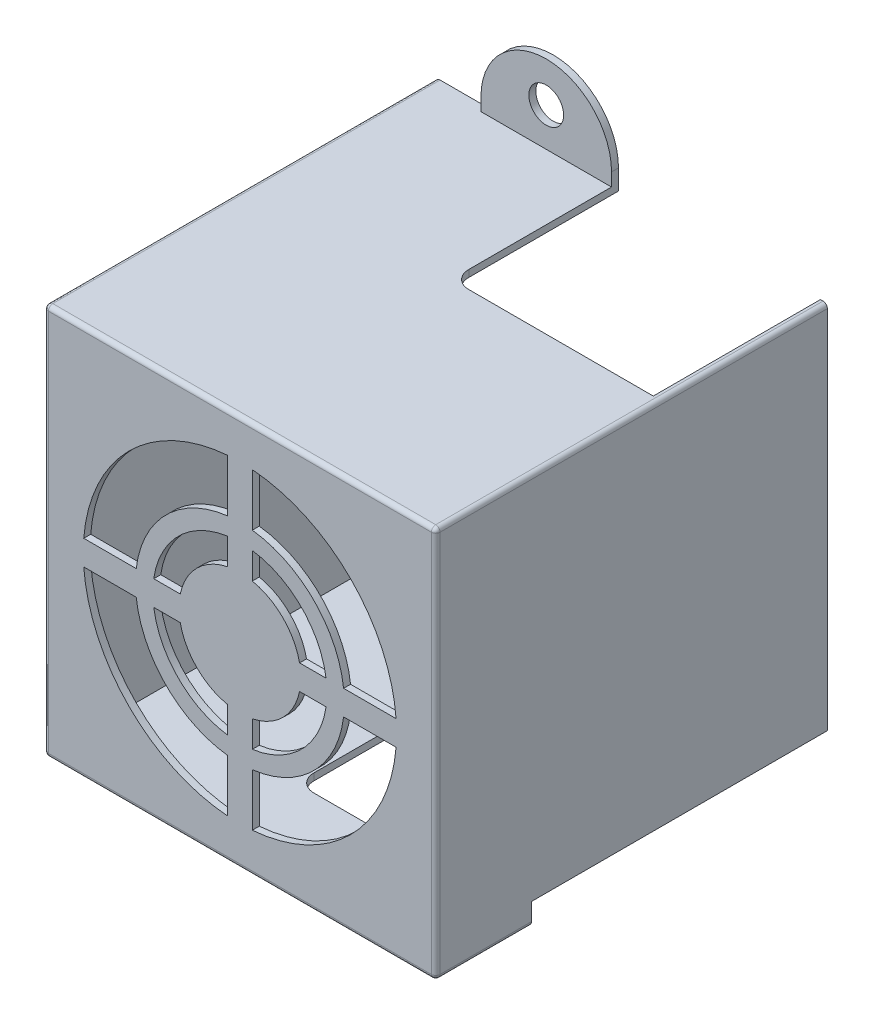
from build123d import *

# Parameters (mm, degrees)
SKETCH1_W           = 45
SKETCH1_H           = 45
BOSS_EXTRUDE1_DEPTH = 45
SHELL1_T            = -0.8
CUT_EXTRUDE1_DEPTH  = 45
SKETCH3_W           = 34
SKETCH3_H           = 2.5
CUT_EXTRUDE2_DEPTH  = 27
FILLET1_R           = 2
FILLET2_R           = 0.5
FILLET3_R           = 0.5
SKETCH4_R           = 2
BOSS_EXTRUDE2_DEPTH = 0.8
CUT_EXTRUDE4_DEPTH  = 0.8


with BuildPart() as part:
    # Sketch1 → Boss-Extrude1 (new body)
    with BuildSketch(Plane(origin=(0, 0, 0), x_dir=(1, 0, 0), z_dir=(0, 1, 0))):
        with Locations((22.5, -22.5)):
            Rectangle(SKETCH1_W, SKETCH1_H)
    extrude(amount=BOSS_EXTRUDE1_DEPTH)

    # Shell1
    shell1_openings = [part.faces().sort_by_distance(p)[0] for p in [
        (22.5, 22.5, 0),
    ]]
    offset(amount=SHELL1_T, openings=shell1_openings, kind=Kind.INTERSECTION)

    # Sketch2 → Cut-Extrude1 (cut)
    with BuildSketch(Plane.XY.offset(45)):
        with BuildLine():
            Line((21.076744556, 34.415298735), (21.076744556, 40.443643553))
            ThreePointArc((21.076744556, 40.443643553), (9.772077939, 35.227922061), (4.556356447, 23.923255444))
            Line((4.556356447, 23.923255444), (10.584701265, 23.923255444))
            ThreePointArc((10.584701265, 23.923255444), (14.014718626, 30.985281374), (21.076744556, 34.415298735))
        make_face()
        with BuildLine():
            ThreePointArc((40.443643553, 23.923255444), (35.227922061, 35.227922061), (23.923255444, 40.443643553))
            Line((23.923255444, 40.443643553), (23.923255444, 34.415298735))
            ThreePointArc((23.923255444, 34.415298735), (30.985281374, 30.985281374), (34.415298735, 23.923255444))
            Line((34.415298735, 23.923255444), (40.443643553, 23.923255444))
        make_face()
        with BuildLine():
            ThreePointArc((23.923255444, 4.556356447), (35.227922061, 9.772077939), (40.443643553, 21.076744556))
            Line((40.443643553, 21.076744556), (34.415298735, 21.076744556))
            ThreePointArc((34.415298735, 21.076744556), (30.985281374, 14.014718626), (23.923255444, 10.584701265))
            Line((23.923255444, 10.584701265), (23.923255444, 4.556356447))
        make_face()
        with BuildLine():
            Line((10.584701265, 21.076744556), (4.556356447, 21.076744556))
            ThreePointArc((4.556356447, 21.076744556), (9.772077939, 9.772077939), (21.076744556, 4.556356447))
            Line((21.076744556, 4.556356447), (21.076744556, 10.584701265))
            ThreePointArc((21.076744556, 10.584701265), (14.014718626, 14.014718626), (10.584701265, 21.076744556))
        make_face()
        with BuildLine():
            ThreePointArc((23.923255444, 12.601800975), (29.571067812, 15.428932188), (32.398199025, 21.076744556))
            Line((32.398199025, 21.076744556), (29.353783184, 21.076744556))
            ThreePointArc((29.353783184, 21.076744556), (27.449747468, 17.550252532), (23.923255444, 15.646216816))
            Line((23.923255444, 15.646216816), (23.923255444, 12.601800975))
        make_face()
        with BuildLine():
            ThreePointArc((32.398199025, 23.923255444), (29.571067812, 29.571067812), (23.923255444, 32.398199025))
            Line((23.923255444, 32.398199025), (23.923255444, 29.353783184))
            ThreePointArc((23.923255444, 29.353783184), (27.449747468, 27.449747468), (29.353783184, 23.923255444))
            Line((29.353783184, 23.923255444), (32.398199025, 23.923255444))
        make_face()
        with BuildLine():
            Line((21.076744556, 29.353783184), (21.076744556, 32.398199025))
            ThreePointArc((21.076744556, 32.398199025), (15.428932188, 29.571067812), (12.601800975, 23.923255444))
            Line((12.601800975, 23.923255444), (15.646216816, 23.923255444))
            ThreePointArc((15.646216816, 23.923255444), (17.550252532, 27.449747468), (21.076744556, 29.353783184))
        make_face()
        with BuildLine():
            Line((15.646216816, 21.076744556), (12.601800975, 21.076744556))
            ThreePointArc((12.601800975, 21.076744556), (15.428932188, 15.428932188), (21.076744556, 12.601800975))
            Line((21.076744556, 12.601800975), (21.076744556, 15.646216816))
            ThreePointArc((21.076744556, 15.646216816), (17.550252532, 17.550252532), (15.646216816, 21.076744556))
        make_face()
    extrude(amount=-CUT_EXTRUDE1_DEPTH, mode=Mode.SUBTRACT)

    # Sketch3 → Cut-Extrude2 (cut)
    with BuildSketch(Plane(origin=(45, 0, 0), x_dir=(0, 0, -1), z_dir=(1, 0, 0))):
        with Locations((-17, 1.25)):
            Rectangle(SKETCH3_W, SKETCH3_H)
    extrude(amount=-CUT_EXTRUDE2_DEPTH, mode=Mode.SUBTRACT)

    # Fillet1
    fillet1_edges = [part.edges().sort_by_distance(p)[0] for p in [
        (18, 0.4, 34),
    ]]
    fillet(fillet1_edges, radius=FILLET1_R)

    # Fillet2
    fillet2_edges = [part.edges().sort_by_distance(p)[0] for p in [
        (45, 22.5, 45),
        (0, 22.5, 45),
    ]]
    fillet(fillet2_edges, radius=FILLET2_R)

    # Fillet3
    fillet3_edges = [part.edges().sort_by_distance(p)[0] for p in [
        (22.5, 0, 45),
        (22.5, 45, 45),
        (45, 0, 39.25),
        (44.853553391, 0, 44.853553391),
        (0.146446609, 0, 44.853553391),
        (45, 45, 22.25),
        (44.853553391, 45, 44.853553391),
        (0.146446609, 45, 44.853553391),
        (0, 45, 22.25),
        (0, 0, 22.25),
    ]]
    fillet(fillet3_edges, radius=FILLET3_R)

    # Sketch4 → Boss-Extrude2 (add)
    # profile 1 of 2: a face of its own
    with BuildSketch(Plane(origin=(0, 0, 0), x_dir=(-1, 0, 0), z_dir=(0, 0, -1))):
        with BuildLine():
            Line((-21, 45), (-6, 45))
            Line((-6, 45), (-6, 46.5))
            ThreePointArc((-6, 46.5), (-13.5, 54), (-21, 46.5))
            Line((-21, 46.5), (-21, 45))
        make_face()
        with Locations((-13.5, 49.4)):
            Circle(SKETCH4_R, mode=Mode.SUBTRACT)
    # profile 2 of 2: a face of its own
    with BuildSketch(Plane(origin=(0, 0, 0), x_dir=(-1, 0, 0), z_dir=(0, 0, -1))):
        with BuildLine():
            Line((1.5, 38), (0, 38))
            Line((0, 38), (0, 23))
            Line((0, 23), (1.5, 23))
            ThreePointArc((1.5, 23), (9, 30.5), (1.5, 38))
        make_face()
        with Locations((4.4, 30.5)):
            Circle(SKETCH4_R, mode=Mode.SUBTRACT)
    extrude(amount=-BOSS_EXTRUDE2_DEPTH)

    # Sketch5 → Cut-Extrude4 (cut)
    with BuildSketch(Plane(origin=(0, 45, 0), x_dir=(1, 0, 0), z_dir=(0, 1, 0))):
        with BuildLine():
            Line((21, 0), (21, -17.2))
            ThreePointArc((21, -17.2), (21.585786438, -18.614213562), (23, -19.2))
            Line((23, -19.2), (44.2, -19.2))
            Line((44.2, -19.2), (44.2, 0))
            Line((44.2, 0), (21, 0))
        make_face()
    extrude(amount=-CUT_EXTRUDE4_DEPTH, mode=Mode.SUBTRACT)


solid = part.part
